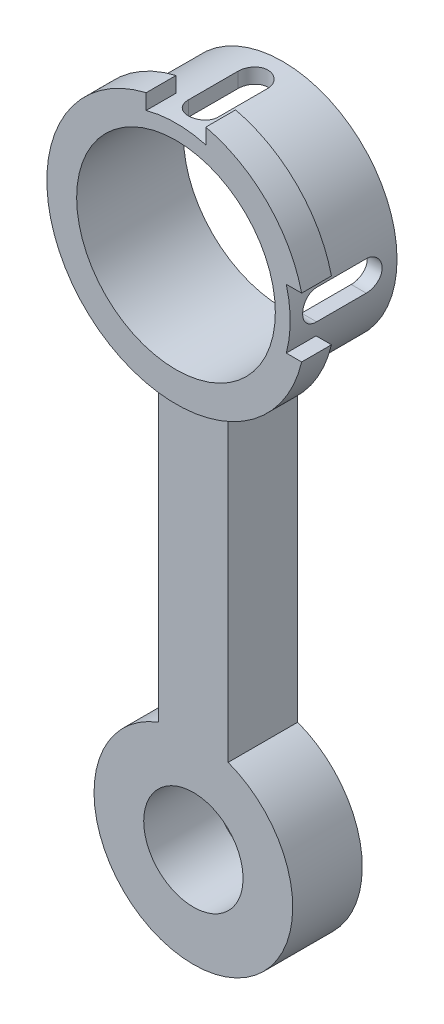
from build123d import *

# Parameters (mm, degrees)
CROQUIS1_R               = 10
SALIENTE_EXTRUIR1_DEPTH  = 3
CROQUIS2_R               = 11.5
CROQUIS2_R_2             = 10
SALIENTE_EXTRUIR3_DEPTH  = 8
SALIENTE_EXTRUIR4_START  = 3
CROQUIS3_R               = 11.5
CROQUIS3_R_2             = 10
SALIENTE_EXTRUIR4_DEPTH  = 3
CORTAR_EXTRUIR1_DEPTH    = 8
SALIENTE_EXTRUIR5_DEPTH  = 8
CORTAR_EXTRUIR2_DEPTH    = 8
CROQUIS11_W              = 0.560243
CROQUIS11_H              = 6
CORTAR_EXTRUIR3_DEPTH    = 8
CROQUIS12_W              = 2.5
CROQUIS12_H              = 0.622045
SALIENTE_EXTRUIR6_DEPTH  = 3
CROQUIS13_W              = 5
CROQUIS13_H              = 50.275028
SALIENTE_EXTRUIR7_DEPTH  = 8
CROQUIS15_W              = 2
CROQUIS15_H              = 50.275028
CORTAR_EXTRUIR4_DEPTH    = 8
SALIENTE_EXTRUIR8_DEPTH  = 7
CROQUIS21_R              = 10
SALIENTE_EXTRUIR9_DEPTH  = 7
CROQUIS22_R              = 5
CORTAR_EXTRUIR5_DEPTH    = 30
CROQUIS23_R              = 10
SALIENTE_EXTRUIR10_DEPTH = 1.25
CORTAR_EXTRUIR6_START    = -1.5
CROQUIS24_R              = 10
CORTAR_EXTRUIR6_DEPTH    = 1.5
SALIENTE_EXTRUIR11_START = -3
CROQUIS25_R              = 13
SALIENTE_EXTRUIR11_DEPTH = 3
CORTAR_EXTRUIR10_DEPTH   = 13
CORTAR_EXTRUIR11_DEPTH   = 13
CORTAR_EXTRUIR14_START   = -10
CROQUIS30_R              = 10
CORTAR_EXTRUIR14_DEPTH   = 10


with BuildPart() as part:
    # Croquis1 → Saliente-Extruir1 (new body)
    with BuildSketch(Plane.XY):
        Circle(CROQUIS1_R)
    extrude(amount=SALIENTE_EXTRUIR1_DEPTH)



with BuildPart() as body_2:
    # Croquis2 → Saliente-Extruir3 (new body)
    with BuildSketch(Plane.XY.offset(3)):
        Circle(CROQUIS2_R)
        Circle(CROQUIS2_R_2, mode=Mode.SUBTRACT)
    extrude(amount=SALIENTE_EXTRUIR3_DEPTH)


with BuildPart() as part_1:
    add(part.part)

    add(body_2.part)  # Saliente-Extruir4 merges body 2
    # Croquis3 → Saliente-Extruir4 (add)
    with BuildSketch(Plane(origin=(0, 0, 3), x_dir=(-1, 0, 0), z_dir=(0, 0, -1)).offset(SALIENTE_EXTRUIR4_START)):
        with Locations(Location((0, 0, 0), (0, 0, 180))):
            Circle(CROQUIS3_R)
        with Locations(Location((0, 0, 0), (0, 0, 180))):
            Circle(CROQUIS3_R_2, mode=Mode.SUBTRACT)
    extrude(amount=-SALIENTE_EXTRUIR4_DEPTH)

    # Croquis4 → Cortar-Extruir1 (cut)
    with BuildSketch(Plane(origin=(0, 11.5, 0), x_dir=(1, 0, 0), z_dir=(0, 1, 0))):
        with BuildLine():
            Line((-1.5, -8), (-1.5, -3))
            ThreePointArc((-1.5, -3), (0, -1.5), (1.5, -3))
            Line((1.5, -3), (1.5, -8))
            ThreePointArc((1.5, -8), (0, -9.5), (-1.5, -8))
        make_face()
    extrude(amount=-CORTAR_EXTRUIR1_DEPTH, mode=Mode.SUBTRACT)


with BuildPart() as body_2_2:
    # Croquis9 → Saliente-Extruir5 (new body)
    with BuildSketch(Plane.XY.offset(11)):
        Polygon((11.5, 0), (11.5, 3), (12.060243, 3), (12.060243, -3), (11.5, -3), align=None)
    extrude(amount=-SALIENTE_EXTRUIR5_DEPTH)


with BuildPart() as cortar_extruir2_tool:
    # Croquis10 → Cortar-Extruir2 (new body)
    with BuildSketch(Plane(origin=(12.060243, 0, 0), x_dir=(0, 0, -1), z_dir=(1, 0, 0))):
        with BuildLine():
            Line((-3, -1.5), (-8, -1.5))
            ThreePointArc((-8, -1.5), (-9.5, 0), (-8, 1.5))
            Line((-8, 1.5), (-3, 1.5))
            ThreePointArc((-3, 1.5), (-1.5, 0), (-3, -1.5))
        make_face()
    extrude(amount=-CORTAR_EXTRUIR2_DEPTH)


with BuildPart() as part_2:
    add(part_1.part)

    # Cortar-Extruir2: cut by cortar_extruir2_tool
    add(cortar_extruir2_tool.part, mode=Mode.SUBTRACT)

    # Croquis12 → Saliente-Extruir6 (add)
    with BuildSketch(Plane.XY.offset(3)):
        with Locations((-1.25, -11.188978)):
            Rectangle(CROQUIS12_W, CROQUIS12_H)
        with Locations((1.25, -11.188978)):
            Rectangle(CROQUIS12_W, CROQUIS12_H)
        Polygon((2.5, -11.5), (2.5, -61.5), (-2.5, -61.5), (-2.5, -11.5), (0, -11.5), align=None)
    extrude(amount=-SALIENTE_EXTRUIR6_DEPTH)

    # Croquis13 → Saliente-Extruir7 (add)
    with BuildSketch(Plane.XY.offset(3)):
        with Locations((0, -36.362486)):
            Rectangle(CROQUIS13_W, CROQUIS13_H)
    extrude(amount=SALIENTE_EXTRUIR7_DEPTH)

    # Croquis15 → Cortar-Extruir4 (cut)
    with BuildSketch(Plane(origin=(2.5, 0, 0), x_dir=(0, 0, -1), z_dir=(1, 0, 0))):
        with Locations((-10, -36.362486)):
            Rectangle(CROQUIS15_W, CROQUIS15_H)
        with Locations((-1, -36.362486)):
            Rectangle(CROQUIS15_W, CROQUIS15_H)
    extrude(amount=-CORTAR_EXTRUIR4_DEPTH, mode=Mode.SUBTRACT)

    # Croquis16 → Saliente-Extruir8 (add)
    with BuildSketch(Plane.XY.offset(9)):
        Polygon((-2.5, -61.5), (-3.5, -61.5), (-3.5, -10.232956), (3.5, -10.232956), (3.5, -61.5), (2.5, -61.5), align=None)
    extrude(amount=-SALIENTE_EXTRUIR8_DEPTH)

    # Croquis21 → Saliente-Extruir9 (add)
    with BuildSketch(Plane(origin=(0, 0, 2), x_dir=(-1, 0, 0), z_dir=(0, 0, -1))):
        with Locations((0, -52.724972)):
            Circle(CROQUIS21_R)
    extrude(amount=-SALIENTE_EXTRUIR9_DEPTH)

    # Croquis22 → Cortar-Extruir5 (cut)
    with BuildSketch(Plane(origin=(0, 0, 2), x_dir=(-1, 0, 0), z_dir=(0, 0, -1))):
        with Locations((0, -52.724972)):
            Circle(CROQUIS22_R)
    extrude(amount=-CORTAR_EXTRUIR5_DEPTH, mode=Mode.SUBTRACT)

    # Croquis23 → Saliente-Extruir10 (add)
    with BuildSketch(Plane.XY.offset(11)):
        with BuildLine():
            Line((-2.5, -11.224972), (2.5, -11.224972))
            ThreePointArc((2.5, -11.224972), (0, 11.5), (-2.5, -11.224972))
        make_face()
        with Locations(Location((0, 0, 0), (0, 0, 98.626927))):
            Circle(CROQUIS23_R, mode=Mode.SUBTRACT)
    extrude(amount=SALIENTE_EXTRUIR10_DEPTH)

    # Croquis24 → Cortar-Extruir6 (cut)
    with BuildSketch(Plane.XY.offset(12.25).offset(CORTAR_EXTRUIR6_START)):
        with BuildLine():
            Line((-2.5, -11.224972), (2.5, -11.224972))
            ThreePointArc((2.5, -11.224972), (0, 11.5), (-2.5, -11.224972))
        make_face()
        with Locations(Location((0, 0, 0), (0, 0, 98.626927))):
            Circle(CROQUIS24_R, mode=Mode.SUBTRACT)
    extrude(amount=CORTAR_EXTRUIR6_DEPTH, mode=Mode.SUBTRACT)

    # Croquis25 → Saliente-Extruir11 (add)
    with BuildSketch(Plane.XY.offset(10.75).offset(SALIENTE_EXTRUIR11_START)):
        Circle(CROQUIS25_R)
        with BuildLine():
            ThreePointArc((2.5, -11.224972), (0, 11.5), (-2.5, -11.224972))
            Line((-2.5, -11.224972), (2.5, -11.224972))
        make_face(mode=Mode.SUBTRACT)
    extrude(amount=SALIENTE_EXTRUIR11_DEPTH)

    # Croquis27 → Cortar-Extruir10 (cut)
    with BuildSketch(Plane(origin=(0, 0, 0), x_dir=(-1, 0, 0), z_dir=(0, 0, -1))):
        with BuildLine():
            ThreePointArc((-3, 11.101802), (-1.513156, 11.400016), (0, 11.5))
            Line((0, 11.5), (-3, 11.5))
            Line((-3, 11.5), (-3, 11.369881))
            Line((-3, 11.369881), (-3, 11.101802))
        make_face()
        with BuildLine():
            Line((3, 11.369881), (3, 11.5))
            Line((3, 11.5), (0, 11.5))
            ThreePointArc((0, 11.5), (1.513156, 11.400016), (3, 11.101802))
            Line((3, 11.101802), (3, 11.369881))
        make_face()
        Polygon((0, 11.5), (3, 11.5), (3, 12.649111), (3, 13.586373), (-0.001501, 13.586373), (-3, 13.586373), (-3, 11.5), align=None)
    extrude(amount=-CORTAR_EXTRUIR10_DEPTH, mode=Mode.SUBTRACT)

    # Croquis28 → Cortar-Extruir11 (cut)
    with BuildSketch(Plane(origin=(0, 0, 0), x_dir=(-1, 0, 0), z_dir=(0, 0, -1))):
        Polygon((-13.802598, 3), (-11.5, 3), (-11.5, 0), (-11.5, -3), (-13.802598, -3), align=None)
        with BuildLine():
            Line((-11.5, 3), (-11.5, 0))
            ThreePointArc((-11.5, 0), (-11.400016, 1.513156), (-11.101802, 3))
            Line((-11.101802, 3), (-11.5, 3))
        make_face()
        with BuildLine():
            ThreePointArc((-11.101802, -3), (-11.400016, -1.513156), (-11.5, 0))
            Line((-11.5, 0), (-11.5, -3))
            Line((-11.5, -3), (-11.101802, -3))
        make_face()
    extrude(amount=-CORTAR_EXTRUIR11_DEPTH, mode=Mode.SUBTRACT)

    # Croquis30 → Cortar-Extruir14 (cut)
    with BuildSketch(Plane.XY.offset(3).offset(CORTAR_EXTRUIR14_START)):
        Circle(CROQUIS30_R)
    extrude(amount=CORTAR_EXTRUIR14_DEPTH, mode=Mode.SUBTRACT)


with BuildPart() as body_2_2_1:
    add(body_2_2.part)

    # Cortar-Extruir2: cut by cortar_extruir2_tool
    add(cortar_extruir2_tool.part, mode=Mode.SUBTRACT)

    # Croquis11 → Cortar-Extruir3 (cut)
    with BuildSketch(Plane.XY.offset(11)):
        with Locations((11.780121, 0)):
            Rectangle(CROQUIS11_W, CROQUIS11_H)
    extrude(amount=-CORTAR_EXTRUIR3_DEPTH, mode=Mode.SUBTRACT)


solid = part_2.part
